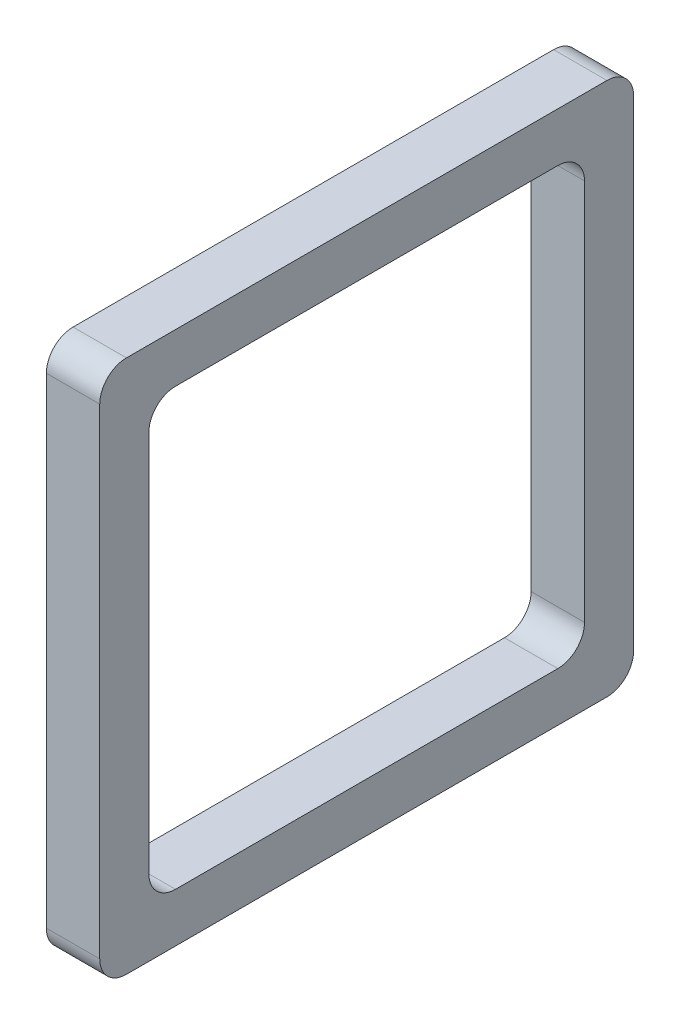
from build123d import *

# Parameters (mm, degrees)
SKETCH1_W           = 31.75
SKETCH1_H           = 31.75
SKETCH1_W_2         = 25.908
SKETCH1_H_2         = 25.908
BOSS_EXTRUDE1_DEPTH = 1.5875
FILLET1_R           = 1.5875


with BuildPart() as part:
    # Sketch1 → Boss-Extrude1 (new, symmetric)
    with BuildSketch(Plane(origin=(0, 0, 0), x_dir=(0, 0, -1), z_dir=(1, 0, 0))):
        with Locations((15.875, 15.875)):
            Rectangle(SKETCH1_W, SKETCH1_H)
        with Locations((15.875, 15.875)):
            Rectangle(SKETCH1_W_2, SKETCH1_H_2, mode=Mode.SUBTRACT)
    extrude(amount=BOSS_EXTRUDE1_DEPTH, both=True)

    # Fillet1
    fillet1_edges = [part.edges().sort_by_distance(p)[0] for p in [
        (0, 2.921, -2.921),
        (0, 2.921, -28.829),
        (0, 28.829, -28.829),
        (0, 28.829, -2.921),
        (0, 31.75, 0),
        (0, 31.75, -31.75),
        (0, 0, -31.75),
        (0, 0, 0),
    ]]
    fillet(fillet1_edges, radius=FILLET1_R)


solid = part.part
